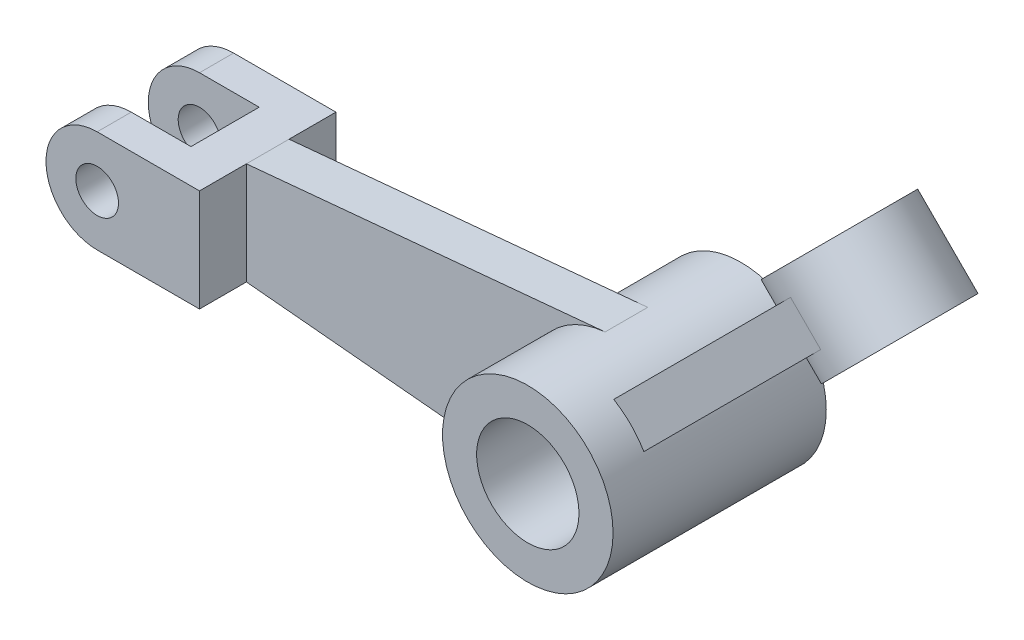
from build123d import *

# Parameters (mm, degrees)
SKETCH1_R           = 10
SKETCH1_R_2         = 6
BOSS_EXTRUDE1_DEPTH = 12.5
BOSS_EXTRUDE2_DEPTH = 2.5
SKETCH2_3_R         = 2.5
BOSS_EXTRUDE3_DEPTH = 8
SKETCH3_W           = 13
SKETCH3_H           = 8
CUT_EXTRUDE1_DEPTH  = 65.290356975
BOSS_EXTRUDE4_DEPTH = 2.5
SKETCH4_5_R         = 4
BOSS_EXTRUDE5_DEPTH = 5


with BuildPart() as part:
    # Sketch1 → Boss-Extrude1 (new, symmetric)
    with BuildSketch(Plane.XY):
        Circle(SKETCH1_R)
        Circle(SKETCH1_R_2, mode=Mode.SUBTRACT)
    extrude(amount=BOSS_EXTRUDE1_DEPTH, both=True)

    # Sketch2 → Boss-Extrude2 (add, symmetric)
    with BuildSketch(Plane.XY):
        with BuildLine():
            Line((-0.936363066, 9.956064695), (-43, 6))
            Line((-43, 6), (-43, -6))
            Line((-43, -6), (-0.936363066, -9.956064695))
            ThreePointArc((-0.936363066, -9.956064695), (-10, 0), (-0.936363066, 9.956064695))
        make_face()
    extrude(amount=BOSS_EXTRUDE2_DEPTH, both=True)

    # Sketch2<3> → Boss-Extrude3 (add, symmetric)
    with BuildSketch(Plane.XY):
        with BuildLine():
            Line((-43, 6), (-55, 6))
            ThreePointArc((-55, 6), (-61, 0), (-55, -6))
            Line((-55, -6), (-43, -6))
            Line((-43, -6), (-43, 6))
        make_face()
        with Locations((-55, 0)):
            Circle(SKETCH2_3_R, mode=Mode.SUBTRACT)
    extrude(amount=BOSS_EXTRUDE3_DEPTH, both=True)

    # Sketch3 → Cut-Extrude1 (cut, through all)
    with BuildSketch(Plane(origin=(0, 6, 0), x_dir=(1, 0, 0), z_dir=(0, 1, 0))):
        with Locations((-54.5, 0)):
            Rectangle(SKETCH3_W, SKETCH3_H)
    extrude(amount=-CUT_EXTRUDE1_DEPTH, mode=Mode.SUBTRACT)

    # Sketch4 → Boss-Extrude4 (add, symmetric)
    with BuildSketch(Plane(origin=(0, 0, 0), x_dir=(0.7071067811865512, 0.7071067811865438, 0), z_dir=(-0.7071067811865438, 0.7071067811865512, 0))):
        with BuildLine():
            Line((39, 7.5), (8.997395084, 7.5))
            Line((8.997395084, 7.5), (8.997395084, -7.5))
            Line((8.997395084, -7.5), (39, -7.5))
            ThreePointArc((39, -7.5), (31.5, 0), (39, 7.5))
        make_face()
    extrude(amount=BOSS_EXTRUDE4_DEPTH, both=True)

    # Sketch4<5> → Boss-Extrude5 (add, symmetric)
    with BuildSketch(Plane(origin=(0, 0, 0), x_dir=(0.7071067811865512, 0.7071067811865438, 0), z_dir=(-0.7071067811865438, 0.7071067811865512, 0))):
        with BuildLine():
            ThreePointArc((46.5, 0), (44.303300859, 5.303300859), (39, 7.5))
            ThreePointArc((39, 7.5), (31.5, 0), (39, -7.5))
            ThreePointArc((39, -7.5), (44.303300859, -5.303300859), (46.5, 0))
        make_face()
        with Locations((39, 0)):
            Circle(SKETCH4_5_R, mode=Mode.SUBTRACT)
    extrude(amount=BOSS_EXTRUDE5_DEPTH, both=True)


solid = part.part
